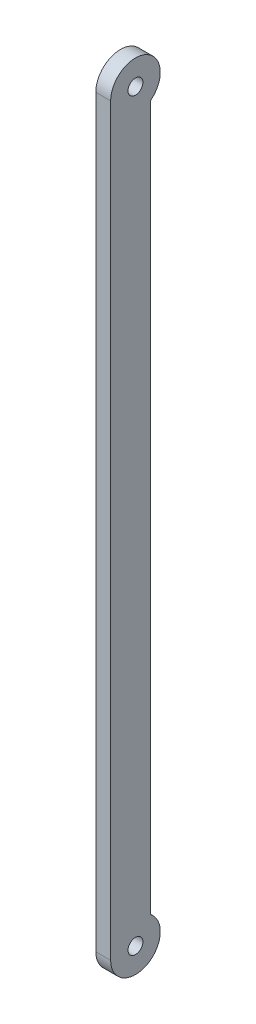
from build123d import *

# Parameters (mm, degrees)
CROQUIS1_R              = 1.5
SALIENTE_EXTRUIR2_DEPTH = 3


with BuildPart() as part:
    # Croquis1 → Saliente-Extruir2 (new body)
    with BuildSketch(Plane(origin=(0, 0, 0), x_dir=(0, 0, -1), z_dir=(1, 0, 0))):
        with BuildLine():
            Line((-5, 150), (-5, 0))
            ThreePointArc((-5, 0), (2.236067977, -4.472135955), (3, 4))
            Line((3, 4), (3, 146))
            ThreePointArc((3, 146), (2.236067977, 154.472135955), (-5, 150))
        make_face()
        with Locations((0, 150)):
            Circle(CROQUIS1_R, mode=Mode.SUBTRACT)
        Circle(CROQUIS1_R, mode=Mode.SUBTRACT)
    extrude(amount=SALIENTE_EXTRUIR2_DEPTH)


solid = part.part
